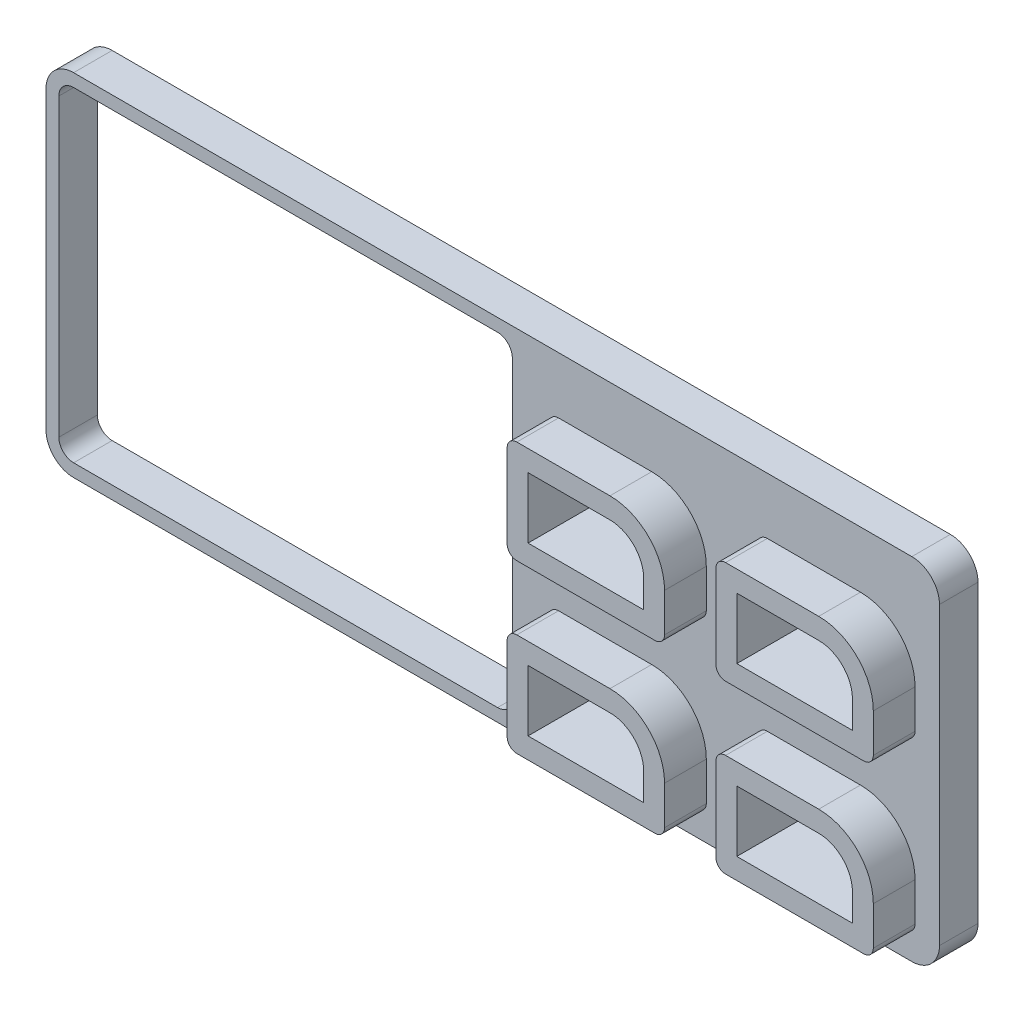
from build123d import *

# Parameters (mm, degrees)
BOSS_EXTRU_1_DEPTH      = 6
BOSS_EXTRU_2_DEPTH      = 9.5
BOSS_EXTRU_3_DEPTH      = 6.5
ENL_V_MAT_EXTRU_1_DEPTH = 87.546230421
ENL_V_MAT_EXTRU_2_DEPTH = 1.25
BOSS_EXTRU_4_DEPTH      = 12.5
BOSS_EXTRU_4_2_DEPTH    = 12.5
BOSS_EXTRU_4_3_DEPTH    = 12.5
BOSS_EXTRU_4_4_DEPTH    = 12.5
BOSS_EXTRU_5_DEPTH      = 6


with BuildPart() as part:
    # Esquisse1 → Boss.-Extru.1 (new body)
    with BuildSketch(Plane.XY):
        with BuildLine():
            Line((2, 0), (68, 0))
            ThreePointArc((68, 0), (69.414213562, 0.585786438), (70, 2))
            Line((70, 2), (70, 48))
            ThreePointArc((70, 48), (69.414213562, 49.414213562), (68, 50))
            Line((68, 50), (2, 50))
            ThreePointArc((2, 50), (0.585786438, 49.414213562), (0, 48))
            Line((0, 48), (0, 2))
            ThreePointArc((0, 2), (0.585786438, 0.585786438), (2, 0))
        make_face()
    extrude(amount=BOSS_EXTRU_1_DEPTH)

    # Esquisse2 → Boss.-Extru.2 (add)
    with BuildSketch(Plane.XY.offset(6)):
        with BuildLine():
            Line((9, 47), (61, 47))
            ThreePointArc((61, 47), (64.535533906, 45.535533906), (66, 42))
            Line((66, 42), (66, 27))
            ThreePointArc((66, 27), (64.535533906, 23.464466094), (61, 22))
            Line((61, 22), (56.5, 22))
            Line((56.5, 22), (56.5, 25.5))
            Line((56.5, 25.5), (60, 25.5))
            ThreePointArc((60, 25.5), (61.767766953, 26.232233047), (62.5, 28))
            Line((62.5, 28), (62.5, 41))
            ThreePointArc((62.5, 41), (61.767766953, 42.767766953), (60, 43.5))
            Line((60, 43.5), (10, 43.5))
            ThreePointArc((10, 43.5), (8.232233047, 42.767766953), (7.5, 41))
            Line((7.5, 41), (7.5, 28))
            ThreePointArc((7.5, 28), (8.232233047, 26.232233047), (10, 25.5))
            Line((10, 25.5), (13.5, 25.5))
            Line((13.5, 25.5), (13.5, 22))
            Line((13.5, 22), (9, 22))
            ThreePointArc((9, 22), (5.464466094, 23.464466094), (4, 27))
            Line((4, 27), (4, 42))
            ThreePointArc((4, 42), (5.464466094, 45.535533906), (9, 47))
        make_face()
    extrude(amount=BOSS_EXTRU_2_DEPTH)

    # Esquisse4 → Boss.-Extru.3 (add)
    with BuildSketch(Plane.XY.offset(6)):
        with BuildLine():
            Line((45, 1.5), (66.5, 1.5))
            ThreePointArc((66.5, 1.5), (67.560660172, 1.939339828), (68, 3))
            Line((68, 3), (68, 9))
            ThreePointArc((68, 9), (65.51040764, 15.01040764), (59.5, 17.5))
            Line((59.5, 17.5), (45, 17.5))
            ThreePointArc((45, 17.5), (43.939339828, 17.060660172), (43.5, 16))
            Line((43.5, 16), (43.5, 3))
            ThreePointArc((43.5, 3), (43.939339828, 1.939339828), (45, 1.5))
        make_face()
        with BuildLine():
            Line((46.75, 4.75), (46.75, 14.25))
            Line((46.75, 14.25), (59.5, 14.25))
            ThreePointArc((59.5, 14.25), (63.212310601, 12.712310601), (64.75, 9))
            Line((64.75, 9), (64.75, 4.75))
            Line((64.75, 4.75), (46.75, 4.75))
        make_face(mode=Mode.SUBTRACT)
    extrude(amount=BOSS_EXTRU_3_DEPTH)

    # Esquisse5 → Enlèv. mat.-Extru.1 (cut, through all)
    with BuildSketch(Plane.XY.offset(6)):
        with BuildLine():
            Line((46.75, 4.75), (64.75, 4.75))
            Line((64.75, 4.75), (64.75, 9))
            ThreePointArc((64.75, 9), (63.212310601, 12.712310601), (59.5, 14.25))
            Line((59.5, 14.25), (46.75, 14.25))
            Line((46.75, 14.25), (46.75, 4.75))
        make_face()
        with BuildLine():
            Line((60, 25.5), (10, 25.5))
            ThreePointArc((10, 25.5), (8.232233047, 26.232233047), (7.5, 28))
            Line((7.5, 28), (7.5, 41))
            ThreePointArc((7.5, 41), (8.232233047, 42.767766953), (10, 43.5))
            Line((10, 43.5), (60, 43.5))
            ThreePointArc((60, 43.5), (61.767766953, 42.767766953), (62.5, 41))
            Line((62.5, 41), (62.5, 28))
            ThreePointArc((62.5, 28), (61.767766953, 26.232233047), (60, 25.5))
        make_face()
    extrude(amount=-ENL_V_MAT_EXTRU_1_DEPTH, mode=Mode.SUBTRACT)

    # Esquisse6 → Enlèv. mat.-Extru.2 (cut)
    # profile 1 of 6: a face of its own
    with BuildSketch(Plane.XY.offset(6)):
        with BuildLine():
            add(Edge.make_bspline(
                [(9.98125, 9.15), (9.94151225, 9.152572673), (9.863195503, 9.157642999), (9.753210696, 9.208851358), (9.655170057, 9.288929049), (9.60457435, 9.360022023), (9.577929688, 9.397460938)],
                knots=[0, 0, 0, 0, 0.959160072, 1.890351017, 2.889018652, 4, 4, 4, 4], degree=3))
            add(Edge.make_bspline(
                [(9.577929688, 9.397460938), (9.555039589, 9.437994011), (9.503936785, 9.528485264), (9.444559776, 9.689977546), (9.383582079, 9.884507049), (9.350820269, 10.027438016), (9.333203125, 10.104296875)],
                knots=[0, 0, 0, 0, 0.742751013, 1.658213032, 2.74074123, 4, 4, 4, 4], degree=3))
            Line((9.333203125, 10.104296875), (9.170507813, 10.897265625))
            add(Edge.make_bspline(
                [(9.170507813, 10.897265625), (9.162063675, 10.930478046), (9.144190904, 11.000775102), (9.120790184, 11.114387165), (9.090669195, 11.240473819), (9.063224027, 11.382219058), (9.030938447, 11.536818991), (9.000199405, 11.706212518), (8.966098288, 11.888970437), (8.928359571, 12.08553135), (8.892511406, 12.296435224), (8.852248192, 12.520464411), (8.811201363, 12.758809908), (8.769390414, 13.011457122), (8.723780906, 13.277899485), (8.677478841, 13.558204991), (8.629563722, 13.852141071), (8.597594428, 14.052724412), (8.58125, 14.155273438)],
                knots=[0, 0, 0, 0, 0.496658207, 1.051221438, 1.68101768, 2.375400972, 3.143623008, 3.970205625, 4.870641242, 5.838436678, 6.871229342, 7.971369117, 9.137717576, 10.376808206, 11.683232474, 13.055897193, 14.494815811, 16, 16, 16, 16], degree=3))
            Line((8.58125, 14.155273438), (7.643359375, 11.373046875))
            Line((7.643359375, 11.373046875), (7.365820313, 10.496679688))
            add(Edge.make_bspline(
                [(7.365820313, 10.496679688), (7.338399285, 10.413435477), (7.285871215, 10.253971808), (7.197076337, 10.029299386), (7.110227316, 9.826640315), (7.045261396, 9.702448964), (7.014453125, 9.643554688)],
                knots=[0, 0, 0, 0, 1.138108356, 2.180174859, 3.13699879, 4, 4, 4, 4], degree=3))
            add(Edge.make_bspline(
                [(7.014453125, 9.643554688), (6.998289241, 9.617971786), (6.966916713, 9.568317859), (6.909732883, 9.50452134), (6.850756066, 9.448298498), (6.786364608, 9.402949233), (6.717025251, 9.368507163), (6.643911558, 9.343787748), (6.566658978, 9.328283944), (6.513679359, 9.326107542), (6.48671875, 9.325)],
                knots=[0, 0, 0, 0, 1.12138879, 2.176506675, 3.170017907, 4.141537379, 5.087232601, 6.03413754, 6.999599269, 8, 8, 8, 8], degree=3))
            add(Edge.make_bspline(
                [(6.48671875, 9.325), (6.442895177, 9.327946144), (6.356824973, 9.333732419), (6.236381954, 9.386429395), (6.131236088, 9.471412651), (6.080120224, 9.547570594), (6.053320313, 9.5875)],
                knots=[0, 0, 0, 0, 0.986319395, 1.937147192, 2.918451782, 4, 4, 4, 4], degree=3))
            add(Edge.make_bspline(
                [(6.053320313, 9.5875), (6.035855727, 9.621866875), (5.999476197, 9.693454648), (5.954588697, 9.811564935), (5.90666618, 9.940597662), (5.880828501, 10.032979854), (5.867382813, 10.081054688)],
                knots=[0, 0, 0, 0, 0.874902059, 1.822461019, 2.866828981, 4, 4, 4, 4], degree=3))
            Line((5.867382813, 10.081054688), (5.733398438, 10.59375))
            add(Edge.make_bspline(
                [(5.733398438, 10.59375), (5.656503387, 10.869589158), (5.500506422, 11.429183974), (5.28647453, 12.287066879), (5.086738125, 13.173788865), (4.966930141, 13.776291049), (4.90625, 14.081445313)],
                knots=[0, 0, 0, 0, 0.958328754, 1.944161251, 2.958762347, 4, 4, 4, 4], degree=3))
            Line((4.90625, 14.081445313), (4.743554688, 13.2625))
            Line((4.743554688, 13.2625), (4.1625, 10.8453125))
            add(Edge.make_bspline(
                [(4.1625, 10.8453125), (4.159128915, 10.807911974), (4.151961622, 10.7283944), (4.134718723, 10.603184869), (4.114668068, 10.464942037), (4.08826968, 10.314124246), (4.056624354, 10.150630351), (4.021006682, 9.974272122), (3.981550861, 9.784994838), (3.952148665, 9.654905267), (3.936914063, 9.5875)],
                knots=[0, 0, 0, 0, 0.704684958, 1.498236636, 2.371575818, 3.326349705, 4.371405418, 5.496944069, 6.703053969, 8, 8, 8, 8], degree=3))
            add(Edge.make_bspline(
                [(3.936914063, 9.5875), (3.925292565, 9.559816052), (3.902977927, 9.506659624), (3.859959142, 9.435525488), (3.813644305, 9.373538656), (3.759625567, 9.323968639), (3.70011878, 9.284889215), (3.634820258, 9.257348339), (3.564073136, 9.240403308), (3.515005519, 9.238484143), (3.48984375, 9.2375)],
                knots=[0, 0, 0, 0, 1.182980922, 2.271462135, 3.271240398, 4.225523803, 5.148115151, 6.066492127, 7.00850128, 8, 8, 8, 8], degree=3))
            add(Edge.make_bspline(
                [(3.48984375, 9.2375), (3.454472301, 9.238987729), (3.386404423, 9.241850676), (3.290904348, 9.273867009), (3.20538017, 9.323395776), (3.161073954, 9.371539251), (3.138476563, 9.39609375)],
                knots=[0, 0, 0, 0, 1.060616523, 2.041022336, 3.000867405, 4, 4, 4, 4], degree=3))
            add(Edge.make_bspline(
                [(3.138476563, 9.39609375), (3.12104166, 9.419179036), (3.085832988, 9.465798296), (3.051523678, 9.547863698), (3.028089071, 9.636777468), (3.026050694, 9.698987924), (3.025, 9.731054688)],
                knots=[0, 0, 0, 0, 0.958743918, 1.936122096, 2.936161401, 4, 4, 4, 4], degree=3))
            add(Edge.make_bspline(
                [(3.025, 9.731054688), (3.026353012, 9.795783944), (3.029137867, 9.929013783), (3.042627838, 10.133943057), (3.068218521, 10.349523947), (3.102129656, 10.575737195), (3.146634661, 10.81314601), (3.199268474, 11.061430494), (3.264501854, 11.319927567), (3.312277094, 11.495260953), (3.33671875, 11.584960938)],
                knots=[0, 0, 0, 0, 0.824042072, 1.69609536, 2.612788883, 3.586582681, 4.607146524, 5.686861406, 6.816605879, 8, 8, 8, 8], degree=3))
            Line((3.33671875, 11.584960938), (3.833007813, 13.445703125))
            Line((3.833007813, 13.445703125), (4.094140625, 14.899023438))
            add(Edge.make_bspline(
                [(4.094140625, 14.899023438), (4.110582906, 14.980233399), (4.142162068, 15.136205836), (4.19403641, 15.358138464), (4.245898421, 15.558306367), (4.297370459, 15.736416976), (4.349692009, 15.892468872), (4.405229653, 16.025660067), (4.45769822, 16.138512248), (4.499107174, 16.202764612), (4.51796875, 16.23203125)],
                knots=[0, 0, 0, 0, 1.414207589, 2.716137283, 3.889666348, 4.943215356, 5.880445309, 6.696617245, 7.406315533, 8, 8, 8, 8], degree=3))
            add(Edge.make_bspline(
                [(4.51796875, 16.23203125), (4.548533457, 16.272930794), (4.6064531, 16.350434791), (4.717889984, 16.43574033), (4.839406063, 16.49138048), (4.925721464, 16.497115246), (4.969140625, 16.5)],
                knots=[0, 0, 0, 0, 1.116006581, 2.11481503, 3.051697038, 4, 4, 4, 4], degree=3))
            add(Edge.make_bspline(
                [(4.969140625, 16.5), (4.993398198, 16.499036319), (5.040679835, 16.49715796), (5.108511714, 16.4799833), (5.171594618, 16.453252287), (5.231241217, 16.417001332), (5.282784712, 16.365386574), (5.332355351, 16.307122891), (5.377081606, 16.23748239), (5.400068156, 16.185456331), (5.412109375, 16.158203125)],
                knots=[0, 0, 0, 0, 0.974538665, 1.899521645, 2.795144295, 3.726104902, 4.685870392, 5.714123837, 6.802572119, 8, 8, 8, 8], degree=3))
            add(Edge.make_bspline(
                [(5.412109375, 16.158203125), (5.428114759, 16.119657968), (5.463249552, 16.035044184), (5.508759543, 15.89174731), (5.554057721, 15.722035918), (5.60407409, 15.526430897), (5.652702557, 15.303353512), (5.701269434, 15.05336241), (5.751957602, 14.777187689), (5.784678347, 14.584156311), (5.801757813, 14.483398438)],
                knots=[0, 0, 0, 0, 0.581236301, 1.275921689, 2.09225498, 3.028489211, 4.088314635, 5.272448532, 6.576281799, 8, 8, 8, 8], degree=3))
            add(Edge.make_bspline(
                [(5.801757813, 14.483398438), (5.823031102, 14.355685849), (5.866113547, 14.097043652), (5.942758506, 13.706413045), (6.023898552, 13.306785849), (6.115469469, 12.899721392), (6.217726181, 12.485453636), (6.324923357, 12.062514015), (6.442655583, 11.632407427), (6.526446051, 11.343772331), (6.56875, 11.198046875)],
                knots=[0, 0, 0, 0, 0.920409794, 1.864004282, 2.829825251, 3.819421933, 4.829969225, 5.863304241, 6.92122972, 8, 8, 8, 8], degree=3))
            add(Edge.make_bspline(
                [(6.56875, 11.198046875), (6.682155475, 11.496367429), (6.910229065, 12.096329995), (7.222165177, 13.012908722), (7.511715835, 13.947889969), (7.683937107, 14.580851692), (7.770507813, 14.899023438)],
                knots=[0, 0, 0, 0, 0.983642058, 1.97823584, 2.98371701, 4, 4, 4, 4], degree=3))
            Line((7.770507813, 14.899023438), (7.911328125, 15.573046875))
            add(Edge.make_bspline(
                [(7.911328125, 15.573046875), (7.925476872, 15.637540159), (7.952577765, 15.761072339), (8.005515675, 15.934576295), (8.060410553, 16.090642404), (8.108565823, 16.183711011), (8.131445313, 16.227929688)],
                knots=[0, 0, 0, 0, 1.142374087, 2.188134223, 3.139147904, 4, 4, 4, 4], degree=3))
            add(Edge.make_bspline(
                [(8.131445313, 16.227929688), (8.146172186, 16.256653629), (8.174481358, 16.311869081), (8.227613444, 16.384044343), (8.282088562, 16.447413009), (8.342677808, 16.497667809), (8.406522637, 16.538808133), (8.474957802, 16.567441894), (8.548053684, 16.584588128), (8.598017581, 16.58651311), (8.623632813, 16.5875)],
                knots=[0, 0, 0, 0, 1.199142974, 2.305088297, 3.326121748, 4.301047848, 5.223219202, 6.142892288, 7.047907664, 8, 8, 8, 8], degree=3))
            add(Edge.make_bspline(
                [(8.623632813, 16.5875), (8.655883833, 16.585132725), (8.720720824, 16.580373588), (8.813686475, 16.540809425), (8.898020466, 16.476190969), (8.978882717, 16.390489263), (9.048344115, 16.276486198), (9.115321834, 16.141338256), (9.175332362, 15.980796661), (9.20788859, 15.864537268), (9.225195313, 15.802734375)],
                knots=[0, 0, 0, 0, 0.729308629, 1.466191666, 2.249505672, 3.126830601, 4.121493211, 5.262973959, 6.545011104, 8, 8, 8, 8], degree=3))
            add(Edge.make_bspline(
                [(9.225195313, 15.802734375), (9.231852988, 15.77819025), (9.246796308, 15.72310034), (9.264534003, 15.630571858), (9.285354113, 15.52080947), (9.307368515, 15.393729578), (9.328683573, 15.248638587), (9.351883716, 15.086392029), (9.376685821, 14.906401094), (9.392996762, 14.780546191), (9.4015625, 14.714453125)],
                knots=[0, 0, 0, 0, 0.553116127, 1.241483132, 2.04851274, 2.984162884, 4.047067603, 5.238941889, 6.55002235, 8, 8, 8, 8], degree=3))
            add(Edge.make_bspline(
                [(9.4015625, 14.714453125), (9.424472836, 14.543510031), (9.469411387, 14.208205706), (9.54128262, 13.71482398), (9.619909618, 13.24153677), (9.699547544, 12.786308182), (9.786561858, 12.350917727), (9.87426295, 11.933409188), (9.968901843, 11.535732967), (10.035968408, 11.277691215), (10.06875, 11.1515625)],
                knots=[0, 0, 0, 0, 1.141110976, 2.238285472, 3.29858376, 4.315316321, 5.295745137, 6.236035004, 7.137788224, 8, 8, 8, 8], degree=3))
            Line((10.06875, 11.1515625), (10.290234375, 10.35859375))
            add(Edge.make_bspline(
                [(10.290234375, 10.35859375), (10.304152607, 10.309897656), (10.330495592, 10.217730742), (10.364191713, 10.085641741), (10.394375123, 9.968668577), (10.419762117, 9.866377837), (10.436890026, 9.778512725), (10.451030498, 9.706234173), (10.460244137, 9.648340815), (10.461821186, 9.614409735), (10.4625, 9.599804688)],
                knots=[0, 0, 0, 0, 1.559778982, 2.952187862, 4.198165584, 5.280768401, 6.197425036, 6.954465388, 7.549967658, 8, 8, 8, 8], degree=3))
            add(Edge.make_bspline(
                [(10.4625, 9.599804688), (10.460614745, 9.569071514), (10.456906327, 9.50861738), (10.428729188, 9.421732281), (10.380767792, 9.343768475), (10.31642298, 9.276162954), (10.241096223, 9.220981098), (10.158690532, 9.180554741), (10.071676174, 9.154571466), (10.011506374, 9.151529601), (9.98125, 9.15)],
                knots=[0, 0, 0, 0, 1.009991958, 1.986719327, 2.968954602, 3.997799753, 5.038376203, 6.024038288, 7.006387982, 8, 8, 8, 8], degree=3))
        make_face()
    # profile 2 of 6: a face of its own
    with BuildSketch(Plane.XY.offset(6)):
        with BuildLine():
            add(Edge.make_bspline(
                [(16.54375, 9.325), (16.507536074, 9.328565585), (16.432608606, 9.335942865), (16.326602225, 9.396120328), (16.225610725, 9.487618401), (16.131539169, 9.616736153), (16.038121522, 9.778218947), (15.951174204, 9.976013991), (15.866187745, 10.208556854), (15.816750923, 10.376947), (15.790429688, 10.466601563)],
                knots=[0, 0, 0, 0, 0.599477061, 1.240332184, 1.981336902, 2.857725237, 3.883632495, 5.081363646, 6.446054773, 8, 8, 8, 8], degree=3))
            add(Edge.make_bspline(
                [(15.790429688, 10.466601563), (15.779364183, 10.505302667), (15.755474944, 10.588854211), (15.71991042, 10.724120632), (15.683440927, 10.879306311), (15.643453762, 11.054142275), (15.602836847, 11.249302879), (15.560648196, 11.464541498), (15.515617335, 11.699261103), (15.48502816, 11.862488099), (15.469140625, 11.947265625)],
                knots=[0, 0, 0, 0, 0.637338617, 1.375945868, 2.214304435, 3.161358364, 4.215706084, 5.370487761, 6.634272836, 8, 8, 8, 8], degree=3))
            add(Edge.make_bspline(
                [(15.469140625, 11.947265625), (15.387937427, 11.934530903), (15.213659683, 11.907199731), (14.935787991, 11.852654767), (14.62282044, 11.785403771), (14.402668317, 11.734737591), (14.286523438, 11.708007812)],
                knots=[0, 0, 0, 0, 0.817199407, 1.753867738, 2.815015916, 4, 4, 4, 4], degree=3))
            Line((14.286523438, 11.708007812), (13.109375, 11.445507813))
            add(Edge.make_bspline(
                [(13.109375, 11.445507813), (13.087651476, 11.392124657), (13.04145529, 11.278602642), (12.965094843, 11.10029647), (12.877606786, 10.904751644), (12.778006467, 10.692668744), (12.671048039, 10.461138264), (12.550143165, 10.213472963), (12.420421388, 9.947478818), (12.329323456, 9.765157225), (12.282226563, 9.670898438)],
                knots=[0, 0, 0, 0, 0.706283328, 1.501947701, 2.37692242, 3.331414503, 4.373290632, 5.502321144, 6.708720252, 8, 8, 8, 8], degree=3))
            add(Edge.make_bspline(
                [(12.282226563, 9.670898438), (12.25762778, 9.631616858), (12.211341109, 9.557702077), (12.116699493, 9.473585909), (12.0076584, 9.421463966), (11.92959772, 9.415524694), (11.88984375, 9.4125)],
                knots=[0, 0, 0, 0, 1.121846996, 2.110940414, 3.037958462, 4, 4, 4, 4], degree=3))
            add(Edge.make_bspline(
                [(11.88984375, 9.4125), (11.860461387, 9.413913191), (11.801874975, 9.416730998), (11.717711394, 9.444642321), (11.637710506, 9.486347891), (11.564783249, 9.544409483), (11.504306702, 9.616370203), (11.456756219, 9.697042382), (11.431027995, 9.78787801), (11.427034679, 9.850768483), (11.425, 9.8828125)],
                knots=[0, 0, 0, 0, 0.959520236, 1.91321738, 2.874709434, 3.905108448, 4.94294104, 5.939035053, 6.949895042, 8, 8, 8, 8], degree=3))
            add(Edge.make_bspline(
                [(11.425, 9.8828125), (11.425677693, 9.893778715), (11.427243904, 9.919122661), (11.436305973, 9.961573968), (11.450737288, 10.013656046), (11.4672727, 10.076342009), (11.493752051, 10.14746261), (11.52107262, 10.229865272), (11.557813976, 10.320699165), (11.596801958, 10.422304152), (11.642576515, 10.533247664), (11.692450489, 10.65431778), (11.74921209, 10.784818465), (11.810727875, 10.924984751), (11.875799047, 11.076026087), (11.94869937, 11.235596519), (12.026728231, 11.404871319), (12.07991271, 11.521144948), (12.107226563, 11.580859375)],
                knots=[0, 0, 0, 0, 0.287252042, 0.663866255, 1.132542321, 1.702696392, 2.359033657, 3.117250718, 3.974454919, 4.922446686, 5.965676152, 7.11530323, 8.349438451, 9.690101266, 11.121599063, 12.65362027, 14.281406117, 16, 16, 16, 16], degree=3))
            add(Edge.make_bspline(
                [(12.107226563, 11.580859375), (12.095205464, 11.601506769), (12.071198403, 11.642741207), (12.046195032, 11.71098037), (12.033039273, 11.784062892), (12.030560908, 11.834196252), (12.029296875, 11.859765625)],
                knots=[0, 0, 0, 0, 0.97569968, 1.948547473, 2.953703556, 4, 4, 4, 4], degree=3))
            add(Edge.make_bspline(
                [(12.029296875, 11.859765625), (12.030564654, 11.889939801), (12.033017035, 11.948308483), (12.053179833, 12.032014057), (12.090602164, 12.10561148), (12.13815059, 12.17319498), (12.203119831, 12.22874239), (12.279378409, 12.277978072), (12.371137497, 12.315309671), (12.437428678, 12.333952783), (12.472265625, 12.34375)],
                knots=[0, 0, 0, 0, 1.009779751, 1.953309833, 2.853929492, 3.760216721, 4.700287016, 5.694855049, 6.788613926, 8, 8, 8, 8], degree=3))
            add(Edge.make_bspline(
                [(12.472265625, 12.34375), (12.516325928, 12.426770492), (12.606371171, 12.596437967), (12.747227716, 12.855087799), (12.897413309, 13.122485265), (13.056664472, 13.398481388), (13.221739586, 13.684964644), (13.396471267, 13.980011381), (13.581728953, 14.283023234), (13.707292343, 14.488411385), (13.77109375, 14.592773438)],
                knots=[0, 0, 0, 0, 0.868367668, 1.774667265, 2.721024516, 3.701824684, 4.718674562, 5.775854077, 6.869864537, 8, 8, 8, 8], degree=3))
            add(Edge.make_bspline(
                [(13.77109375, 14.592773438), (13.815130039, 14.662608689), (13.900835752, 14.798525684), (14.028175701, 14.994236668), (14.146218204, 15.178181707), (14.260441925, 15.346793437), (14.368266833, 15.501696885), (14.46778168, 15.644746484), (14.561960468, 15.77344413), (14.650905041, 15.887564915), (14.731799425, 15.98975151), (14.805888776, 16.078399739), (14.875242808, 16.152300533), (14.935466571, 16.214931929), (14.992275733, 16.261508521), (15.040940791, 16.296176013), (15.083923265, 16.319756585), (15.112106617, 16.323388709), (15.124609375, 16.325)],
                knots=[0, 0, 0, 0, 1.783354216, 3.470856639, 5.0436238, 6.504355625, 7.869725228, 9.120561833, 10.268459323, 11.314034723, 12.245706296, 13.083911902, 13.808382701, 14.434865381, 14.959203251, 15.390667921, 15.729686815, 16, 16, 16, 16], degree=3))
            add(Edge.make_bspline(
                [(15.124609375, 16.325), (15.153944582, 16.323447428), (15.210862302, 16.320435046), (15.292913508, 16.296035823), (15.367231786, 16.255953105), (15.434598298, 16.19999998), (15.491533063, 16.126587706), (15.544306187, 16.040017221), (15.587316522, 15.936398531), (15.609336888, 15.861303051), (15.620898438, 15.821875)],
                knots=[0, 0, 0, 0, 0.917322695, 1.779838015, 2.65454497, 3.546200046, 4.500090635, 5.550022207, 6.713666244, 8, 8, 8, 8], degree=3))
            Line((15.620898438, 15.821875), (15.917578125, 14.27421875))
            Line((15.917578125, 14.27421875), (16.6203125, 11.070898438))
            Line((16.6203125, 11.070898438), (16.88828125, 10.318945313))
            add(Edge.make_bspline(
                [(16.88828125, 10.318945313), (16.909005878, 10.26035528), (16.946523395, 10.154290523), (16.987971993, 10.009418378), (17.017986515, 9.897191516), (17.022948872, 9.831878941), (17.025, 9.804882813)],
                knots=[0, 0, 0, 0, 1.397155254, 2.529251602, 3.392084717, 4, 4, 4, 4], degree=3))
            add(Edge.make_bspline(
                [(17.025, 9.804882813), (17.023123196, 9.772332192), (17.019432209, 9.708317037), (16.991382828, 9.616791679), (16.944693063, 9.533442771), (16.880954012, 9.461474286), (16.806082373, 9.4010565), (16.723591166, 9.356969944), (16.635284445, 9.329183436), (16.574484659, 9.326404679), (16.54375, 9.325)],
                knots=[0, 0, 0, 0, 1.035843273, 2.037124518, 3.018631196, 4.058029714, 5.080662642, 6.067951126, 7.02333764, 8, 8, 8, 8], degree=3))
        make_face()
        with BuildLine():
            Line((14.88125, 14.65703125), (13.69453125, 12.570703125))
            add(Edge.make_bspline(
                [(13.69453125, 12.570703125), (13.740514866, 12.582285421), (13.837743248, 12.606775185), (13.992539452, 12.641512052), (14.163044415, 12.680722848), (14.351196407, 12.718125159), (14.555829596, 12.759055244), (14.776999698, 12.803565221), (15.015250076, 12.846341988), (15.179307554, 12.876441999), (15.2640625, 12.891992188)],
                knots=[0, 0, 0, 0, 0.710206803, 1.501670901, 2.376034108, 3.330493633, 4.374633661, 5.501772615, 6.709372284, 8, 8, 8, 8], degree=3))
            Line((15.2640625, 12.891992188), (14.88125, 14.65703125))
        make_face(mode=Mode.SUBTRACT)
    # profile 3 of 6: a face of its own
    with BuildSketch(Plane.XY.offset(6)):
        with BuildLine():
            add(Edge.make_bspline(
                [(22.950390625, 9.4125), (22.92238765, 9.414510918), (22.865540144, 9.418593187), (22.782278573, 9.447190523), (22.702332537, 9.495373725), (22.655250588, 9.538712067), (22.63046875, 9.561523438)],
                knots=[0, 0, 0, 0, 0.92759402, 1.883064472, 2.885739552, 4, 4, 4, 4], degree=3))
            add(Edge.make_bspline(
                [(22.63046875, 9.561523438), (22.505127147, 9.685094519), (22.257579548, 9.929145367), (21.867277515, 10.265936566), (21.46539548, 10.570250692), (21.053812761, 10.844216362), (20.631658252, 11.087395088), (20.198511969, 11.298070362), (19.755377923, 11.479192469), (19.451602907, 11.573461577), (19.3, 11.620507813)],
                knots=[0, 0, 0, 0, 1.06668371, 2.106682745, 3.122149944, 4.120443899, 5.101746213, 6.072804342, 7.03820772, 8, 8, 8, 8], degree=3))
            Line((19.3, 11.620507813), (19.3, 10.7140625))
            Line((19.3, 10.7140625), (19.3, 9.802148438))
            add(Edge.make_bspline(
                [(19.3, 9.802148438), (19.298575439, 9.769619921), (19.295777751, 9.705737357), (19.269213465, 9.614153806), (19.224138455, 9.531752829), (19.163822567, 9.459886848), (19.092007962, 9.398794664), (19.007981672, 9.356450611), (18.916170204, 9.328930531), (18.851767086, 9.326332112), (18.81875, 9.325)],
                knots=[0, 0, 0, 0, 1.030253241, 2.023308341, 2.993791058, 3.989789173, 4.985787287, 5.962283232, 6.955338332, 8, 8, 8, 8], degree=3))
            add(Edge.make_bspline(
                [(18.81875, 9.325), (18.785742823, 9.326344805), (18.721359032, 9.328967981), (18.629408852, 9.356310377), (18.545839957, 9.399346378), (18.472022478, 9.457984244), (18.411835379, 9.530139876), (18.368578352, 9.613162113), (18.341629188, 9.704326001), (18.338893163, 9.768237831), (18.3375, 9.80078125)],
                knots=[0, 0, 0, 0, 1.045277453, 2.038917917, 3.015989466, 4.014672757, 5.011257971, 5.975499002, 6.969139467, 8, 8, 8, 8], degree=3))
            add(Edge.make_bspline(
                [(18.3375, 9.80078125), (18.337723518, 9.833141132), (18.338195817, 9.901518618), (18.334211463, 10.009492975), (18.332730982, 10.128957481), (18.32591871, 10.259220182), (18.32171365, 10.401046565), (18.31213825, 10.553607753), (18.305335006, 10.717795126), (18.293043105, 10.888995802), (18.284890182, 11.06091105), (18.274015453, 11.225314296), (18.268529703, 11.378549592), (18.260204324, 11.520182528), (18.257493838, 11.650606668), (18.252032287, 11.769948174), (18.251610624, 11.877999826), (18.250517444, 11.946355564), (18.25, 11.978710938)],
                knots=[0, 0, 0, 0, 0.712445534, 1.505420618, 2.378647905, 3.342790384, 4.377117212, 5.50258648, 6.708224005, 7.995139022, 9.281467094, 10.497664906, 11.622642009, 12.657406812, 13.6211837, 14.49469921, 15.287483804, 16, 16, 16, 16], degree=3))
            add(Edge.make_bspline(
                [(18.25, 11.978710938), (18.250292594, 12.016539548), (18.250909659, 12.09631791), (18.255317283, 12.22211666), (18.262231396, 12.360667355), (18.271907627, 12.512430791), (18.284213627, 12.677413705), (18.299326666, 12.855149892), (18.317169571, 13.045644775), (18.33748721, 13.244727763), (18.357926095, 13.444255114), (18.375599003, 13.635221746), (18.39072972, 13.81295506), (18.403085284, 13.977022097), (18.412818415, 14.127871345), (18.419639956, 14.265515151), (18.424093913, 14.390400289), (18.42470868, 14.469267633), (18.425, 14.506640625)],
                knots=[0, 0, 0, 0, 0.71629614, 1.510627306, 2.383268869, 3.343040369, 4.390087922, 5.51592497, 6.720652734, 8.012939535, 9.305226336, 10.51854632, 11.644383367, 12.682825442, 13.633984758, 14.506626321, 15.292332674, 16, 16, 16, 16], degree=3))
            add(Edge.make_bspline(
                [(18.425, 14.506640625), (18.424371088, 14.550855493), (18.422982756, 14.64846043), (18.413898385, 14.808900614), (18.400245784, 14.99759589), (18.38125, 15.205273438), (18.362254216, 15.412950985), (18.348601615, 15.601646261), (18.339517244, 15.762086445), (18.338128912, 15.859691382), (18.3375, 15.90390625)],
                knots=[0, 0, 0, 0, 0.757749544, 1.672742668, 2.753375099, 4, 5.246624901, 6.327257332, 7.242250456, 8, 8, 8, 8], degree=3))
            add(Edge.make_bspline(
                [(18.3375, 15.90390625), (18.3393976, 15.94643752), (18.343131374, 16.030123308), (18.37085098, 16.151320483), (18.417670591, 16.265008777), (18.463397339, 16.332089732), (18.486523438, 16.366015625)],
                knots=[0, 0, 0, 0, 1.032692214, 2.03195585, 3.004670488, 4, 4, 4, 4], degree=3))
            add(Edge.make_bspline(
                [(18.486523438, 16.366015625), (18.517044009, 16.403076696), (18.576507203, 16.475282737), (18.695889264, 16.549213446), (18.831601871, 16.58986915), (18.926472352, 16.588312351), (18.975976563, 16.5875)],
                knots=[0, 0, 0, 0, 1.01891203, 1.985145153, 2.948631896, 4, 4, 4, 4], degree=3))
            Line((18.975976563, 16.5875), (20.0984375, 16.5))
            add(Edge.make_bspline(
                [(20.0984375, 16.5), (20.20082844, 16.48525505), (20.399327452, 16.456669923), (20.682000698, 16.388090857), (20.941102792, 16.302030268), (21.099006604, 16.225494042), (21.17578125, 16.18828125)],
                knots=[0, 0, 0, 0, 1.100642549, 2.133747954, 3.092606825, 4, 4, 4, 4], degree=3))
            add(Edge.make_bspline(
                [(21.17578125, 16.18828125), (21.252287922, 16.147059192), (21.402085268, 16.066347868), (21.615675484, 15.935691733), (21.815127668, 15.802198266), (22.000015549, 15.665453196), (22.170354521, 15.526007768), (22.325420712, 15.382419869), (22.464850714, 15.234227421), (22.591181779, 15.084151525), (22.702690238, 14.930469398), (22.799043555, 14.772878426), (22.879244074, 14.610951494), (22.947750004, 14.446700368), (22.997557171, 14.277699156), (23.034593311, 14.105920016), (23.059303933, 13.930859032), (23.061431984, 13.812647661), (23.0625, 13.753320313)],
                knots=[0, 0, 0, 0, 1.285088098, 2.516156837, 3.70133193, 4.833679489, 5.915871266, 6.955543635, 7.956797627, 8.923330369, 9.854944987, 10.762351267, 11.651551949, 12.525187581, 13.390909519, 14.252845023, 15.123146355, 16, 16, 16, 16], degree=3))
            add(Edge.make_bspline(
                [(23.0625, 13.753320313), (23.060818915, 13.695302631), (23.057486362, 13.580289374), (23.025843292, 13.410470425), (22.975881802, 13.245766492), (22.902527622, 13.087133827), (22.813144739, 12.932008513), (22.700138336, 12.783813572), (22.569094311, 12.639255424), (22.46871611, 12.551496093), (22.4171875, 12.506445313)],
                knots=[0, 0, 0, 0, 0.958014663, 1.899151822, 2.844979062, 3.795592604, 4.781247835, 5.798066499, 6.869649273, 8, 8, 8, 8], degree=3))
            add(Edge.make_bspline(
                [(22.4171875, 12.506445313), (22.372918009, 12.470837154), (22.283515343, 12.398926132), (22.141235348, 12.299864386), (21.991614403, 12.205847714), (21.83310445, 12.120653755), (21.666958147, 12.040344199), (21.491933387, 11.969152915), (21.310036543, 11.900976333), (21.184664559, 11.862744908), (21.12109375, 11.843359375)],
                knots=[0, 0, 0, 0, 0.929713851, 1.877566122, 2.835927701, 3.820636964, 4.821600353, 5.855058901, 6.912391442, 8, 8, 8, 8], degree=3))
            add(Edge.make_bspline(
                [(21.12109375, 11.843359375), (21.23864568, 11.778952798), (21.468066009, 11.653253644), (21.797375765, 11.456097485), (22.102948803, 11.255204567), (22.38745302, 11.053413827), (22.646866964, 10.846732266), (22.884359503, 10.638971065), (23.099166889, 10.428590249), (23.227896318, 10.281479329), (23.290820313, 10.209570313)],
                knots=[0, 0, 0, 0, 1.177489967, 2.298049355, 3.370731458, 4.389520182, 5.361182849, 6.283175119, 7.160802, 8, 8, 8, 8], degree=3))
            add(Edge.make_bspline(
                [(23.290820313, 10.209570313), (23.309379205, 10.185030422), (23.345171872, 10.137702808), (23.384906418, 10.059509993), (23.406940236, 9.977884118), (23.410655227, 9.922579893), (23.4125, 9.895117188)],
                knots=[0, 0, 0, 0, 1.072503085, 2.068428621, 3.040829592, 4, 4, 4, 4], degree=3))
            add(Edge.make_bspline(
                [(23.4125, 9.895117188), (23.411118609, 9.863476997), (23.408405682, 9.801338513), (23.380854999, 9.711517788), (23.336381763, 9.628736266), (23.276559187, 9.554141858), (23.20522507, 9.492041587), (23.126314556, 9.445275538), (23.040034816, 9.418364939), (22.980648846, 9.414479633), (22.950390625, 9.4125)],
                knots=[0, 0, 0, 0, 1.024641278, 2.012303189, 3.018298371, 4.060307688, 5.098529397, 6.072917027, 7.018116539, 8, 8, 8, 8], degree=3))
        make_face()
        with BuildLine():
            Line((19.979492188, 15.568945313), (19.3, 15.625))
            Line((19.3, 15.625), (19.351953125, 15.064453125))
            add(Edge.make_bspline(
                [(19.351953125, 15.064453125), (19.356931875, 15.009766098), (19.366388259, 14.90589635), (19.380383957, 14.757961107), (19.384868696, 14.625610016), (19.386662493, 14.542642832), (19.3875, 14.50390625)],
                knots=[0, 0, 0, 0, 1.172826967, 2.227607707, 3.172487062, 4, 4, 4, 4], degree=3))
            add(Edge.make_bspline(
                [(19.3875, 14.50390625), (19.387430948, 14.438273937), (19.387285137, 14.299682992), (19.378868646, 14.080512688), (19.370480514, 13.838419289), (19.360111633, 13.66944692), (19.3546875, 13.581054688)],
                knots=[0, 0, 0, 0, 0.852682441, 1.800547017, 2.849429868, 4, 4, 4, 4], degree=3))
            Line((19.3546875, 13.581054688), (19.3, 12.659570313))
            add(Edge.make_bspline(
                [(19.3, 12.659570313), (19.326891635, 12.659247301), (19.391633142, 12.658469652), (19.494566386, 12.653559442), (19.598496717, 12.651484424), (19.664583279, 12.650439536), (19.692382813, 12.65)],
                knots=[0, 0, 0, 0, 0.822146546, 1.979314634, 3.149991952, 4, 4, 4, 4], degree=3))
            add(Edge.make_bspline(
                [(19.692382813, 12.65), (19.784455222, 12.651227155), (19.962323103, 12.653597805), (20.220569168, 12.666736501), (20.461161952, 12.690716802), (20.68369085, 12.726562137), (20.888513575, 12.769552387), (21.075550732, 12.822842821), (21.24552326, 12.885521948), (21.34895686, 12.938844132), (21.398632813, 12.964453125)],
                knots=[0, 0, 0, 0, 1.261455283, 2.436912221, 3.541518553, 4.572091567, 5.523601269, 6.40695542, 7.234910064, 8, 8, 8, 8], degree=3))
            add(Edge.make_bspline(
                [(21.398632813, 12.964453125), (21.440099733, 12.989758578), (21.523838727, 13.040860833), (21.642005737, 13.130467108), (21.757190538, 13.229077091), (21.827631314, 13.302875723), (21.863476563, 13.340429688)],
                knots=[0, 0, 0, 0, 0.970995645, 1.960844865, 2.962333636, 4, 4, 4, 4], degree=3))
            add(Edge.make_bspline(
                [(21.863476563, 13.340429688), (21.899360811, 13.380976175), (21.965723864, 13.455961407), (22.039412482, 13.572205852), (22.089263575, 13.678429068), (22.096606423, 13.748349555), (22.1, 13.780664063)],
                knots=[0, 0, 0, 0, 1.272857899, 2.353978121, 3.239273211, 4, 4, 4, 4], degree=3))
            add(Edge.make_bspline(
                [(22.1, 13.780664063), (22.097969529, 13.834154951), (22.093901441, 13.941325031), (22.058406458, 14.099954777), (21.999101372, 14.254251603), (21.921403432, 14.407866005), (21.816920148, 14.556453524), (21.692186994, 14.703585182), (21.542955517, 14.845868818), (21.432577757, 14.934917981), (21.375390625, 14.981054688)],
                knots=[0, 0, 0, 0, 0.882366302, 1.767838804, 2.667832895, 3.606679194, 4.602184672, 5.659035605, 6.787137544, 8, 8, 8, 8], degree=3))
            add(Edge.make_bspline(
                [(21.375390625, 14.981054688), (21.320236706, 15.021785547), (21.211175063, 15.102326957), (21.041883579, 15.21074683), (20.868831136, 15.303216304), (20.695315993, 15.384555504), (20.519496116, 15.452062717), (20.341660536, 15.505131842), (20.161736379, 15.5459194), (20.040267206, 15.561266603), (19.979492188, 15.568945313)],
                knots=[0, 0, 0, 0, 1.072583951, 2.120933036, 3.141837587, 4.140335143, 5.117603438, 6.085357071, 7.042041242, 8, 8, 8, 8], degree=3))
        make_face(mode=Mode.SUBTRACT)
    # profile 4 of 6: a face of its own
    with BuildSketch(Plane.XY.offset(6)):
        with BuildLine():
            add(Edge.make_bspline(
                [(29.875195313, 15.348828125), (29.845571421, 15.34920634), (29.783124599, 15.350003613), (29.683772648, 15.352917005), (29.573488268, 15.357104505), (29.451756856, 15.362181648), (29.319190552, 15.370947848), (29.175177065, 15.380453154), (29.020220866, 15.391303672), (28.913147362, 15.399364531), (28.858007813, 15.403515625)],
                knots=[0, 0, 0, 0, 0.697868793, 1.471099364, 2.34124454, 3.297639375, 4.340941311, 5.470636532, 6.697455892, 8, 8, 8, 8], degree=3))
            add(Edge.make_bspline(
                [(28.858007813, 15.403515625), (28.753210921, 15.411137837), (28.557368604, 15.425382074), (28.283447378, 15.440444643), (28.049611571, 15.449748084), (27.90690768, 15.449921398), (27.8421875, 15.45)],
                knots=[0, 0, 0, 0, 1.239602774, 2.316544658, 3.236506215, 4, 4, 4, 4], degree=3))
            Line((27.8421875, 15.45), (27.525, 15.45))
            add(Edge.make_bspline(
                [(27.525, 15.45), (27.52574906, 15.393030335), (27.527355271, 15.270870224), (27.533527125, 15.074929622), (27.540106198, 14.854349852), (27.548583245, 14.608720233), (27.557602236, 14.338888879), (27.570665174, 14.044079121), (27.583702721, 13.724564527), (27.594563303, 13.503117703), (27.600195313, 13.38828125)],
                knots=[0, 0, 0, 0, 0.662748673, 1.421132645, 2.280353958, 3.229821545, 4.280136861, 5.420916878, 6.662555861, 8, 8, 8, 8], degree=3))
            add(Edge.make_bspline(
                [(27.600195313, 13.38828125), (27.605326267, 13.280734759), (27.615304223, 13.071593518), (27.627895574, 12.766712353), (27.636421387, 12.480444812), (27.647001884, 12.212996662), (27.653825754, 11.964154026), (27.657612696, 11.733535636), (27.66056299, 11.521621148), (27.661345847, 11.386719544), (27.66171875, 11.322460938)],
                knots=[0, 0, 0, 0, 1.250205099, 2.431222486, 3.543103862, 4.575656673, 5.539115669, 6.433559639, 7.253846715, 8, 8, 8, 8], degree=3))
            add(Edge.make_bspline(
                [(27.66171875, 11.322460938), (27.662012762, 11.291922861), (27.662662425, 11.22444442), (27.667660006, 11.112823881), (27.672430645, 10.980611598), (27.681090313, 10.834384754), (27.688427501, 10.688080916), (27.696519153, 10.555089849), (27.698596827, 10.441997388), (27.699564342, 10.373176559), (27.7, 10.3421875)],
                knots=[0, 0, 0, 0, 0.746989454, 1.650584799, 2.732845727, 3.983195791, 5.233545855, 6.316323389, 7.241863914, 8, 8, 8, 8], degree=3))
            add(Edge.make_bspline(
                [(27.7, 10.3421875), (27.698501643, 10.292009962), (27.695590606, 10.1945241), (27.678530155, 10.053718265), (27.647400371, 9.92326437), (27.61570312, 9.842855488), (27.600195313, 9.803515625)],
                knots=[0, 0, 0, 0, 1.091849351, 2.121265404, 3.080833362, 4, 4, 4, 4], degree=3))
            add(Edge.make_bspline(
                [(27.600195313, 9.803515625), (27.589217013, 9.779610744), (27.568253435, 9.733963255), (27.53139939, 9.67126921), (27.48886826, 9.618256355), (27.440224858, 9.576467866), (27.389615603, 9.540150762), (27.332123568, 9.518035605), (27.271643988, 9.501412087), (27.229355195, 9.50047657), (27.2078125, 9.5)],
                knots=[0, 0, 0, 0, 1.191296126, 2.274835755, 3.287394835, 4.252751747, 5.174740045, 6.091162971, 7.027603017, 8, 8, 8, 8], degree=3))
            add(Edge.make_bspline(
                [(27.2078125, 9.5), (27.178456486, 9.50151727), (27.120055151, 9.504535753), (27.03542781, 9.530863808), (26.954780829, 9.571039837), (26.880392229, 9.626277465), (26.817213501, 9.695480476), (26.771494387, 9.776366042), (26.742719566, 9.866336145), (26.739275459, 9.929531682), (26.7375, 9.962109375)],
                knots=[0, 0, 0, 0, 0.960963467, 1.911756486, 2.881171454, 3.906711639, 4.933449695, 5.93104195, 6.933439213, 8, 8, 8, 8], degree=3))
            add(Edge.make_bspline(
                [(26.7375, 9.962109375), (26.738825254, 9.990872928), (26.742017987, 10.060168568), (26.760889084, 10.168989127), (26.779378507, 10.277866645), (26.782639525, 10.347606396), (26.783984375, 10.376367188)],
                knots=[0, 0, 0, 0, 0.827477602, 1.993515503, 3.172522398, 4, 4, 4, 4], degree=3))
            add(Edge.make_bspline(
                [(26.783984375, 10.376367188), (26.783738235, 10.41875405), (26.783190207, 10.513127972), (26.777132663, 10.669010751), (26.767200264, 10.8530891), (26.755440569, 11.055867445), (26.742722688, 11.258577583), (26.735159258, 11.443204342), (26.728647133, 11.599954758), (26.728152215, 11.695242273), (26.727929688, 11.738085938)],
                knots=[0, 0, 0, 0, 0.746291465, 1.661610404, 2.746329365, 3.99217145, 5.238013535, 6.322346595, 7.245684818, 8, 8, 8, 8], degree=3))
            add(Edge.make_bspline(
                [(26.727929688, 11.738085938), (26.727500387, 11.795962949), (26.726601189, 11.917190259), (26.724645893, 12.107279782), (26.716555102, 12.314130331), (26.709193446, 12.537943966), (26.697367345, 12.778514177), (26.686155215, 13.035652873), (26.668595401, 13.309436548), (26.6572293, 13.497653108), (26.651367188, 13.594726563)],
                knots=[0, 0, 0, 0, 0.747431598, 1.565545969, 2.45468398, 3.420487031, 4.457335108, 5.565002064, 6.744139946, 8, 8, 8, 8], degree=3))
            add(Edge.make_bspline(
                [(26.651367188, 13.594726563), (26.644897607, 13.698627352), (26.632442426, 13.898656268), (26.615892146, 14.187584875), (26.602499592, 14.453771624), (26.590458578, 14.697141091), (26.578349672, 14.917627222), (26.572405555, 15.115492301), (26.56663801, 15.290482211), (26.563812281, 15.399412347), (26.5625, 15.45)],
                knots=[0, 0, 0, 0, 1.345045701, 2.589470545, 3.739184836, 4.788629233, 5.737804393, 6.592105666, 7.346167443, 8, 8, 8, 8], degree=3))
            Line((26.5625, 15.45), (26.145507813, 15.445898438))
            add(Edge.make_bspline(
                [(26.145507813, 15.445898438), (26.064382139, 15.446485222), (25.906203813, 15.44762933), (25.675570056, 15.454699619), (25.458502216, 15.464813722), (25.254782876, 15.481761081), (25.064626286, 15.501803702), (24.887548259, 15.525961621), (24.724277822, 15.555938997), (24.620550242, 15.580390901), (24.570507813, 15.5921875)],
                knots=[0, 0, 0, 0, 1.228039821, 2.394424294, 3.492699509, 4.517052489, 5.488393293, 6.38694271, 7.221795155, 8, 8, 8, 8], degree=3))
            add(Edge.make_bspline(
                [(24.570507813, 15.5921875), (24.541011869, 15.600883233), (24.484685655, 15.617488828), (24.408992856, 15.655064678), (24.343769889, 15.699045976), (24.291429793, 15.753411006), (24.249293643, 15.815574331), (24.221218472, 15.886603825), (24.202233209, 15.964894477), (24.200767243, 16.019991805), (24.2, 16.048828125)],
                knots=[0, 0, 0, 0, 1.149028852, 2.19421508, 3.150112674, 4.078991136, 5.001582701, 5.94244518, 6.923136375, 8, 8, 8, 8], degree=3))
            add(Edge.make_bspline(
                [(24.2, 16.048828125), (24.200972051, 16.079559497), (24.202888186, 16.140138098), (24.228265083, 16.226382282), (24.262887707, 16.308790626), (24.299117869, 16.355756902), (24.317578125, 16.3796875)],
                knots=[0, 0, 0, 0, 1.025624002, 2.021740715, 2.992022952, 4, 4, 4, 4], degree=3))
            add(Edge.make_bspline(
                [(24.317578125, 16.3796875), (24.341133316, 16.404194771), (24.386716948, 16.451620856), (24.472352415, 16.501148252), (24.567927351, 16.528258054), (24.634592958, 16.52765467), (24.668945313, 16.52734375)],
                knots=[0, 0, 0, 0, 1.02661616, 1.986691385, 2.962555135, 4, 4, 4, 4], degree=3))
            add(Edge.make_bspline(
                [(24.668945313, 16.52734375), (24.68444747, 16.526536799), (24.719605963, 16.524706656), (24.778399077, 16.518930808), (24.849846571, 16.510286974), (24.934176131, 16.500879811), (25.031788094, 16.490214928), (25.141960567, 16.476042628), (25.265132511, 16.461546986), (25.351188022, 16.449998032), (25.396289062, 16.443945312)],
                knots=[0, 0, 0, 0, 0.5087507, 1.153833472, 1.935733641, 2.867738609, 3.935007618, 5.154125614, 6.508498809, 8, 8, 8, 8], degree=3))
            add(Edge.make_bspline(
                [(25.396289062, 16.443945312), (25.468274172, 16.436024283), (25.605303613, 16.420945968), (25.800260139, 16.402208875), (25.974063176, 16.392759257), (26.082609628, 16.390370986), (26.133203125, 16.389257813)],
                knots=[0, 0, 0, 0, 1.175525529, 2.237707298, 3.178595432, 4, 4, 4, 4], degree=3))
            add(Edge.make_bspline(
                [(26.133203125, 16.389257813), (26.184244143, 16.389770995), (26.298629826, 16.390921065), (26.487779815, 16.391391348), (26.712423508, 16.396815395), (26.96036942, 16.399681613), (27.20826113, 16.405490273), (27.432925422, 16.410251814), (27.622072918, 16.41085743), (27.736458864, 16.411993199), (27.7875, 16.4125)],
                knots=[0, 0, 0, 0, 0.740441683, 1.659369853, 2.743726197, 3.999939121, 5.256273803, 6.340630147, 7.259558317, 8, 8, 8, 8], degree=3))
            add(Edge.make_bspline(
                [(27.7875, 16.4125), (27.818488307, 16.411987535), (27.884109857, 16.410902328), (27.987603054, 16.410394717), (28.101506478, 16.405394155), (28.225984309, 16.400684578), (28.361221846, 16.391270989), (28.507183199, 16.384273999), (28.663423207, 16.372528551), (28.826564282, 16.360576785), (28.990148268, 16.348415791), (29.146416746, 16.337154056), (29.292291584, 16.329051098), (29.427241506, 16.322791972), (29.552021945, 16.315100035), (29.665985487, 16.310872256), (29.769469178, 16.310147303), (29.834636182, 16.309094424), (29.865625, 16.30859375)],
                knots=[0, 0, 0, 0, 0.714819212, 1.513717576, 2.38669285, 3.344109317, 4.386598804, 5.513033055, 6.714223687, 8.000039341, 9.285854994, 10.497530974, 11.613470957, 12.65537741, 13.613313006, 14.496792413, 15.285180788, 16, 16, 16, 16], degree=3))
            add(Edge.make_bspline(
                [(29.865625, 16.30859375), (29.897276237, 16.307282372), (29.958561374, 16.304743198), (30.046274009, 16.277160019), (30.125087268, 16.232598176), (30.195091705, 16.172345998), (30.251353829, 16.098664904), (30.296147776, 16.016321216), (30.32033649, 15.923475639), (30.323424609, 15.858912944), (30.325, 15.825976563)],
                knots=[0, 0, 0, 0, 1.019441967, 1.973908376, 2.93606128, 3.927491239, 4.934424242, 5.91541954, 6.936560224, 8, 8, 8, 8], degree=3))
            add(Edge.make_bspline(
                [(30.325, 15.825976563), (30.323592848, 15.793420587), (30.320853723, 15.730047986), (30.294462483, 15.639579211), (30.255626868, 15.555553377), (30.197052293, 15.484297041), (30.130014224, 15.4236222), (30.052092552, 15.379933762), (29.96628595, 15.352958629), (29.905927723, 15.350221686), (29.875195313, 15.348828125)],
                knots=[0, 0, 0, 0, 1.065832428, 2.074721264, 3.071561902, 4.083108628, 5.07938795, 6.023783637, 6.993776074, 8, 8, 8, 8], degree=3))
        make_face()
    # profile 5 of 6: a face of its own
    with BuildSketch(Plane.XY.offset(6)):
        with BuildLine():
            add(Edge.make_bspline(
                [(34.567382813, 15.292773438), (34.514049332, 15.293766192), (34.400908997, 15.295872198), (34.221668147, 15.307234931), (34.023430673, 15.326823071), (33.885119971, 15.343957473), (33.812695313, 15.352929688)],
                knots=[0, 0, 0, 0, 0.844908799, 1.792368763, 2.844001688, 4, 4, 4, 4], degree=3))
            Line((33.812695313, 15.352929688), (33.058007813, 15.45))
            add(Edge.make_bspline(
                [(33.058007813, 15.45), (33.040978023, 15.227216526), (33.007323087, 14.786943122), (32.97618134, 14.133160187), (32.953936672, 13.494620294), (32.951301556, 13.073847034), (32.95, 12.866015625)],
                knots=[0, 0, 0, 0, 1.0364049, 2.048183843, 3.035944677, 4, 4, 4, 4], degree=3))
            add(Edge.make_bspline(
                [(32.95, 12.866015625), (32.950396347, 12.808593287), (32.951233111, 12.68736385), (32.953814414, 12.495484335), (32.959298287, 12.284467284), (32.967931865, 12.060746803), (32.975624261, 11.837441342), (32.983572759, 11.626938594), (32.985581884, 11.435484829), (32.986485873, 11.314257349), (32.986914063, 11.256835938)],
                knots=[0, 0, 0, 0, 0.856162641, 1.807521568, 2.861054983, 4.003296995, 5.145539007, 6.192478432, 7.143837359, 8, 8, 8, 8], degree=3))
            add(Edge.make_bspline(
                [(32.986914063, 11.256835938), (32.986944251, 11.185732368), (32.98700329, 11.046678942), (32.97893454, 10.843445807), (32.970789477, 10.649576073), (32.9595869, 10.523992133), (32.954101563, 10.4625)],
                knots=[0, 0, 0, 0, 1.072724937, 2.09787044, 3.068622912, 4, 4, 4, 4], degree=3))
            Line((32.954101563, 10.4625), (34.415625, 10.480273438))
            add(Edge.make_bspline(
                [(34.415625, 10.480273438), (34.447330095, 10.479119255), (34.508856855, 10.476879455), (34.595944636, 10.447015177), (34.67564408, 10.403161672), (34.744525994, 10.341140583), (34.80232018, 10.267250661), (34.845155141, 10.183430624), (34.870638294, 10.090721579), (34.873519882, 10.026527667), (34.875, 9.993554688)],
                knots=[0, 0, 0, 0, 1.016134692, 1.97190626, 2.930937747, 3.928796873, 4.932463183, 5.936343928, 6.940010237, 8, 8, 8, 8], degree=3))
            add(Edge.make_bspline(
                [(34.875, 9.993554688), (34.873587803, 9.959652888), (34.870855985, 9.894071751), (34.844852542, 9.799993144), (34.803948559, 9.714159162), (34.746271292, 9.639215635), (34.677168606, 9.57763546), (34.598089592, 9.532562977), (34.511008658, 9.503794777), (34.449572564, 9.501278446), (34.418359375, 9.5)],
                knots=[0, 0, 0, 0, 1.082704447, 2.094431231, 3.098879689, 4.108080834, 5.099958544, 6.040552062, 7.004483931, 8, 8, 8, 8], degree=3))
            add(Edge.make_bspline(
                [(34.418359375, 9.5), (34.370052083, 9.5), (34.2625, 9.5), (34.084765625, 9.5), (33.874674479, 9.5), (33.643164063, 9.5), (33.412109375, 9.5), (33.202473958, 9.5), (33.025195312, 9.5), (32.917643229, 9.5), (32.869335938, 9.5)],
                knots=[0, 0, 0, 0, 0.748455428, 1.666372462, 2.753751103, 4.00353045, 5.253309797, 6.333627538, 7.251544572, 8, 8, 8, 8], degree=3))
            add(Edge.make_bspline(
                [(32.869335938, 9.5), (32.812362762, 9.499368032), (32.686065123, 9.49796709), (32.477326523, 9.488834224), (32.230754043, 9.47528571), (31.95878914, 9.456248174), (31.686823791, 9.437221117), (31.439797728, 9.423621571), (31.22968994, 9.414510435), (31.10202528, 9.413127183), (31.044140625, 9.4125)],
                knots=[0, 0, 0, 0, 0.748172612, 1.658542507, 2.743409755, 3.991026145, 5.238642535, 6.323509783, 7.239859666, 8, 8, 8, 8], degree=3))
            add(Edge.make_bspline(
                [(31.044140625, 9.4125), (31.01300016, 9.414075343), (30.952532885, 9.417134281), (30.865421837, 9.441104499), (30.786627086, 9.481426283), (30.716845589, 9.536086766), (30.659649328, 9.602582205), (30.617675335, 9.677851338), (30.59189723, 9.76039496), (30.588985744, 9.817913613), (30.5875, 9.847265625)],
                knots=[0, 0, 0, 0, 1.063311923, 2.064695416, 3.06085606, 4.070443796, 5.075696449, 6.037910975, 6.998737659, 8, 8, 8, 8], degree=3))
            add(Edge.make_bspline(
                [(30.5875, 9.847265625), (30.589012656, 9.876616656), (30.591999404, 9.934570432), (30.617618453, 10.017314007), (30.658078377, 10.093304125), (30.714419372, 10.159807756), (30.782150395, 10.215220461), (30.858459445, 10.258097078), (30.943934392, 10.281234666), (31.002999083, 10.284475526), (31.033203125, 10.286132813)],
                knots=[0, 0, 0, 0, 1.010275739, 1.994795113, 2.958136824, 3.962281448, 4.978529793, 5.963174608, 6.958424075, 8, 8, 8, 8], degree=3))
            add(Edge.make_bspline(
                [(31.033203125, 10.286132813), (31.059639459, 10.286437863), (31.116640371, 10.287095601), (31.207806736, 10.291513082), (31.310812257, 10.298424041), (31.42564732, 10.308222374), (31.552908801, 10.320067562), (31.691704484, 10.337419523), (31.842673369, 10.354617342), (31.946956456, 10.368027982), (32.001171875, 10.375)],
                knots=[0, 0, 0, 0, 0.65235169, 1.406573319, 2.251878403, 3.199797556, 4.250540251, 5.405519862, 6.651163576, 8, 8, 8, 8], degree=3))
            add(Edge.make_bspline(
                [(32.001171875, 10.375), (32.008428112, 10.439672507), (32.023378127, 10.572917198), (32.03823199, 10.779941404), (32.04611959, 11.000195915), (32.047133951, 11.151556182), (32.04765625, 11.229492188)],
                knots=[0, 0, 0, 0, 0.911939611, 1.878868134, 2.907820727, 4, 4, 4, 4], degree=3))
            add(Edge.make_bspline(
                [(32.04765625, 11.229492188), (32.047445612, 11.285550584), (32.047000269, 11.404072553), (32.041141906, 11.590041987), (32.031451114, 11.793772598), (32.017849911, 12.00834578), (32.002809925, 12.22329154), (31.996538194, 12.425792215), (31.987605527, 12.610280201), (31.987534051, 12.727008253), (31.9875, 12.782617188)],
                knots=[0, 0, 0, 0, 0.865414781, 1.829710956, 2.872152674, 4.014099031, 5.149023177, 6.19818612, 7.141620645, 8, 8, 8, 8], degree=3))
            add(Edge.make_bspline(
                [(31.9875, 12.782617188), (31.987543968, 12.874224495), (31.987634761, 13.06338937), (31.995898806, 13.355034744), (32.004299439, 13.663648215), (32.02057019, 13.988512447), (32.037808115, 14.330362999), (32.059498219, 14.689087236), (32.08752154, 15.06405073), (32.107298764, 15.319666258), (32.117382813, 15.45)],
                knots=[0, 0, 0, 0, 0.823012946, 1.699483876, 2.621201366, 3.596742432, 4.621760727, 5.69652902, 6.825501744, 8, 8, 8, 8], degree=3))
            Line((32.117382813, 15.45), (31.504882813, 15.432226563))
            Line((31.504882813, 15.432226563), (30.889648438, 15.4171875))
            add(Edge.make_bspline(
                [(30.889648438, 15.4171875), (30.857081721, 15.418509378), (30.793563097, 15.421087588), (30.702737367, 15.448872249), (30.61956391, 15.491078105), (30.547027513, 15.550708365), (30.486339687, 15.622483299), (30.443937804, 15.706460266), (30.416173714, 15.799167579), (30.413755937, 15.86449997), (30.4125, 15.8984375)],
                knots=[0, 0, 0, 0, 1.028739135, 2.006468603, 2.981529445, 3.966904178, 4.961438528, 5.93649937, 6.928095031, 8, 8, 8, 8], degree=3))
            add(Edge.make_bspline(
                [(30.4125, 15.8984375), (30.41370207, 15.932709919), (30.415986535, 15.997842677), (30.436053477, 16.09009543), (30.472388801, 16.169097044), (30.520811338, 16.237614063), (30.585926255, 16.2907478), (30.662486748, 16.334708902), (30.754521618, 16.362698883), (30.820661422, 16.371142385), (30.85546875, 16.375585937)],
                knots=[0, 0, 0, 0, 1.124933062, 2.137870454, 3.075480577, 3.964534875, 4.867090771, 5.811958692, 6.848501675, 8, 8, 8, 8], degree=3))
            add(Edge.make_bspline(
                [(30.85546875, 16.375585937), (30.890554668, 16.378377963), (30.967976849, 16.384538973), (31.094165744, 16.393199539), (31.241473098, 16.397518766), (31.40914672, 16.403588231), (31.597838658, 16.407475101), (31.80748693, 16.409662142), (32.03762005, 16.413310054), (32.198045245, 16.412777078), (32.281445313, 16.4125)],
                knots=[0, 0, 0, 0, 0.592040121, 1.306422653, 2.127214331, 3.070581057, 4.128683212, 5.301619568, 6.59719597, 8, 8, 8, 8], degree=3))
            add(Edge.make_bspline(
                [(32.281445313, 16.4125), (32.362119255, 16.412057456), (32.52807924, 16.411147068), (32.78467901, 16.400526778), (33.05586928, 16.385604451), (33.342618417, 16.365238256), (33.643803039, 16.337357944), (33.960195802, 16.304902552), (34.29098259, 16.264806734), (34.516369382, 16.234980708), (34.631640625, 16.219726562)],
                knots=[0, 0, 0, 0, 0.820444117, 1.687792723, 2.611562117, 3.582764976, 4.611281913, 5.687725834, 6.817416436, 8, 8, 8, 8], degree=3))
            add(Edge.make_bspline(
                [(34.631640625, 16.219726562), (34.664662675, 16.213858024), (34.727376439, 16.2027128), (34.814246347, 16.171652234), (34.886093099, 16.126137548), (34.949295622, 16.073370462), (34.993534629, 16.003877424), (35.027711893, 15.925715559), (35.046097373, 15.835454768), (35.048658292, 15.771817288), (35.05, 15.738476563)],
                knots=[0, 0, 0, 0, 1.133235852, 2.152182755, 3.09298808, 3.998953257, 4.909232267, 5.848016526, 6.872540375, 8, 8, 8, 8], degree=3))
            add(Edge.make_bspline(
                [(35.05, 15.738476563), (35.04852717, 15.704456548), (35.045694615, 15.639029081), (35.013143935, 15.5466129), (34.962885514, 15.463965522), (34.914524552, 15.4211114), (34.890039063, 15.399414063)],
                knots=[0, 0, 0, 0, 1.046848289, 2.013303988, 2.994122096, 4, 4, 4, 4], degree=3))
            add(Edge.make_bspline(
                [(34.890039063, 15.399414063), (34.866416451, 15.382966927), (34.819592021, 15.35036563), (34.739791988, 15.318231705), (34.655603616, 15.296355257), (34.597151217, 15.293982053), (34.567382813, 15.292773438)],
                knots=[0, 0, 0, 0, 0.996238231, 1.974730341, 2.968578754, 4, 4, 4, 4], degree=3))
        make_face()
    # profile 6 of 6: a face of its own
    with BuildSketch(Plane.XY.offset(6)):
        with BuildLine():
            add(Edge.make_bspline(
                [(42.4, 10.529492188), (42.39906085, 10.486631962), (42.396899339, 10.387986484), (42.381766506, 10.222031534), (42.35797499, 10.018866438), (42.338258573, 9.871391031), (42.327539062, 9.791210938)],
                knots=[0, 0, 0, 0, 0.692895526, 1.594742227, 2.692298624, 4, 4, 4, 4], degree=3))
            add(Edge.make_bspline(
                [(42.327539062, 9.791210938), (42.320692183, 9.754547831), (42.3077294, 9.685135784), (42.27519628, 9.588582538), (42.22988372, 9.507284713), (42.174688877, 9.439934839), (42.108160956, 9.387349006), (42.03060412, 9.350654013), (41.942338711, 9.32805402), (41.880157089, 9.326048327), (41.84765625, 9.325)],
                knots=[0, 0, 0, 0, 1.20476354, 2.28090613, 3.276722631, 4.197121598, 5.078254434, 5.994044583, 6.951535305, 8, 8, 8, 8], degree=3))
            add(Edge.make_bspline(
                [(41.84765625, 9.325), (41.826626293, 9.326268042), (41.782723642, 9.328915237), (41.7158097, 9.344311709), (41.646339445, 9.371354978), (41.57439308, 9.408664528), (41.498595, 9.455232266), (41.421148725, 9.513807087), (41.33860809, 9.579827453), (41.285793495, 9.630791427), (41.258398437, 9.657226563)],
                knots=[0, 0, 0, 0, 0.730337079, 1.524669504, 2.370705184, 3.311529783, 4.334280597, 5.454178941, 6.679476486, 8, 8, 8, 8], degree=3))
            add(Edge.make_bspline(
                [(41.258398437, 9.657226563), (41.177761724, 9.732890864), (41.013695573, 9.886839981), (40.771494303, 10.130106524), (40.522078093, 10.382925235), (40.267919657, 10.647491291), (40.01061384, 10.926137488), (39.74880958, 11.216287918), (39.483303062, 11.519490044), (39.212186183, 11.834067895), (38.936774691, 12.1611957), (38.657714845, 12.501359981), (38.372722498, 12.852344975), (38.085277049, 13.217319489), (37.792246573, 13.593413851), (37.495155432, 13.98186989), (37.195231733, 14.38391332), (36.993607863, 14.656063012), (36.891601562, 14.79375)],
                knots=[0, 0, 0, 0, 0.786175539, 1.599579029, 2.440502605, 3.311377504, 4.207922437, 5.137132747, 6.090019436, 7.073419425, 8.089895893, 9.130444579, 10.201783443, 11.304500224, 12.433614388, 13.591759313, 14.781613883, 16, 16, 16, 16], degree=3))
            Line((36.891601562, 14.79375), (36.891601562, 13.746484375))
            Line((36.891601562, 13.746484375), (36.891601562, 12.69375))
            add(Edge.make_bspline(
                [(36.891601562, 12.69375), (36.891599843, 12.660026049), (36.89159617, 12.588020858), (36.891627578, 12.474088424), (36.891490071, 12.348307795), (36.892076104, 12.210672871), (36.889577557, 12.061202906), (36.890859374, 11.899409708), (36.888262968, 11.725785456), (36.889076029, 11.543944469), (36.888663673, 11.362110227), (36.889422869, 11.188472279), (36.887037015, 11.026696601), (36.887609799, 10.876757347), (36.887474374, 10.738671984), (36.88750595, 10.612434871), (36.887498747, 10.49804688), (36.887499598, 10.425585939), (36.8875, 10.39140625)],
                knots=[0, 0, 0, 0, 0.703082575, 1.50117631, 2.375278971, 3.32539056, 4.370556493, 5.491688168, 6.69836729, 7.990519051, 9.282670811, 10.489312528, 11.610484461, 12.655607208, 13.615219913, 14.489322574, 15.287416309, 16, 16, 16, 16], degree=3))
            add(Edge.make_bspline(
                [(36.8875, 10.39140625), (36.887531571, 10.34126295), (36.887592737, 10.244113942), (36.879715796, 10.103303138), (36.871066879, 9.972343269), (36.857094145, 9.851052148), (36.840134036, 9.739553763), (36.817296, 9.63768229), (36.794467003, 9.544614561), (36.763256878, 9.462559459), (36.731515568, 9.388764381), (36.692670254, 9.326163108), (36.651866484, 9.271701056), (36.60631562, 9.227247743), (36.556478975, 9.192498152), (36.50294706, 9.167364525), (36.44475296, 9.153533216), (36.404952759, 9.151204176), (36.384375, 9.15)],
                knots=[0, 0, 0, 0, 1.641407543, 3.180108141, 4.616353063, 5.93787564, 7.176700562, 8.306389524, 9.355981834, 10.309543231, 11.177673963, 11.981208954, 12.715390035, 13.401281728, 14.055269273, 14.696189502, 15.325895391, 16, 16, 16, 16], degree=3))
            add(Edge.make_bspline(
                [(36.384375, 9.15), (36.342163515, 9.151328937), (36.260989409, 9.153884528), (36.147574106, 9.187615522), (36.044566125, 9.235575631), (35.990423309, 9.286033399), (35.96328125, 9.311328125)],
                knots=[0, 0, 0, 0, 1.089169767, 2.094510084, 3.044768586, 4, 4, 4, 4], degree=3))
            add(Edge.make_bspline(
                [(35.96328125, 9.311328125), (35.942494308, 9.335598007), (35.901733869, 9.383188028), (35.8613371, 9.468030531), (35.833221411, 9.557901267), (35.83062099, 9.62099709), (35.829296875, 9.653125)],
                knots=[0, 0, 0, 0, 1.015946988, 1.992137409, 2.977611725, 4, 4, 4, 4], degree=3))
            add(Edge.make_bspline(
                [(35.829296875, 9.653125), (35.829542524, 9.689588048), (35.830089319, 9.77075203), (35.836173879, 9.905218198), (35.846139399, 10.064221459), (35.857499528, 10.239716781), (35.871793257, 10.415004128), (35.881094597, 10.574086783), (35.887314297, 10.70854337), (35.887846738, 10.78970837), (35.888085937, 10.826171875)],
                knots=[0, 0, 0, 0, 0.744877641, 1.658041175, 2.749287466, 3.999670801, 5.250712534, 6.341958825, 7.255122359, 8, 8, 8, 8], degree=3))
            add(Edge.make_bspline(
                [(35.888085937, 10.826171875), (35.888494307, 10.879948314), (35.889397595, 10.998898538), (35.892037376, 11.195332326), (35.89760451, 11.42685024), (35.906064397, 11.682481421), (35.913415808, 11.937698724), (35.921509823, 12.169617476), (35.923590165, 12.365622023), (35.924563633, 12.484570608), (35.925, 12.537890625)],
                knots=[0, 0, 0, 0, 0.75381508, 1.667393282, 2.753659635, 3.999915791, 5.252556976, 6.332607107, 7.252572722, 8, 8, 8, 8], degree=3))
            add(Edge.make_bspline(
                [(35.925, 12.537890625), (35.924469527, 12.595311564), (35.923290706, 12.722912919), (35.923172429, 12.933951581), (35.915911613, 13.183643297), (35.911556426, 13.459378822), (35.905892181, 13.735083716), (35.901874288, 13.984825447), (35.898927983, 14.195827664), (35.898050918, 14.323436891), (35.89765625, 14.380859375)],
                knots=[0, 0, 0, 0, 0.747704683, 1.661556449, 2.747733668, 4.000027837, 5.252322007, 6.338385755, 7.252295317, 8, 8, 8, 8], degree=3))
            add(Edge.make_bspline(
                [(35.89765625, 14.380859375), (35.896508561, 14.435097507), (35.893951614, 14.555935181), (35.884359177, 14.754755787), (35.865899935, 14.988974026), (35.841095605, 15.246203634), (35.819213432, 15.503692824), (35.800095918, 15.737812103), (35.790639802, 15.936644818), (35.788068289, 16.057481199), (35.786914062, 16.11171875)],
                knots=[0, 0, 0, 0, 0.750464522, 1.671967386, 2.753134315, 4.000278919, 5.246865685, 6.328032614, 7.249535478, 8, 8, 8, 8], degree=3))
            add(Edge.make_bspline(
                [(35.786914062, 16.11171875), (35.788734796, 16.146699256), (35.792379378, 16.216720114), (35.83147212, 16.317377494), (35.889970708, 16.413381604), (35.969681986, 16.501348752), (36.063703386, 16.576906991), (36.167198595, 16.634650045), (36.278824318, 16.668735334), (36.355441195, 16.672904679), (36.393945312, 16.675)],
                knots=[0, 0, 0, 0, 0.918927669, 1.8394275, 2.810753833, 3.875264035, 4.953204733, 5.981019229, 6.985353173, 8, 8, 8, 8], degree=3))
            add(Edge.make_bspline(
                [(36.393945312, 16.675), (36.415548669, 16.67321209), (36.461381579, 16.669418924), (36.530834348, 16.642864319), (36.602276569, 16.598411617), (36.67867939, 16.539680685), (36.757847427, 16.463618233), (36.839990257, 16.370507938), (36.927309427, 16.261893017), (36.983685106, 16.181347397), (37.01328125, 16.1390625)],
                knots=[0, 0, 0, 0, 0.614134886, 1.302926644, 2.087606647, 3.002747992, 4.038777296, 5.204520825, 6.532427355, 8, 8, 8, 8], degree=3))
            add(Edge.make_bspline(
                [(37.01328125, 16.1390625), (37.110115948, 15.998079274), (37.299935815, 15.721717413), (37.583255107, 15.317810701), (37.85949598, 14.932616897), (38.127358591, 14.56441333), (38.387892012, 14.214366569), (38.642853868, 13.883878867), (38.887942325, 13.570039049), (39.052283179, 13.369742392), (39.132421875, 13.272070313)],
                knots=[0, 0, 0, 0, 1.151001266, 2.256246075, 3.320096876, 4.340853426, 5.320419307, 6.256497473, 7.149803502, 8, 8, 8, 8], degree=3))
            add(Edge.make_bspline(
                [(39.132421875, 13.272070313), (39.317142068, 13.047331272), (39.687551844, 12.596673786), (40.275647157, 11.944144823), (40.885208106, 11.302567002), (41.311133397, 10.890761245), (41.525, 10.683984375)],
                knots=[0, 0, 0, 0, 0.989655899, 1.984505403, 2.98797514, 4, 4, 4, 4], degree=3))
            add(Edge.make_bspline(
                [(41.525, 10.683984375), (41.524491954, 10.720897653), (41.523362978, 10.802926024), (41.522780895, 10.937850607), (41.517905591, 11.096427196), (41.514509427, 11.209896426), (41.512695312, 11.270507813)],
                knots=[0, 0, 0, 0, 0.755108433, 1.677995494, 2.759664502, 4, 4, 4, 4], degree=3))
            Line((41.512695312, 11.270507813), (41.500390625, 11.8515625))
            add(Edge.make_bspline(
                [(41.500390625, 11.8515625), (41.499626112, 12.016081011), (41.498137284, 12.336467433), (41.493519538, 12.804548405), (41.4822425, 13.246621775), (41.467447974, 13.663196099), (41.448398105, 14.053338692), (41.425778193, 14.418050564), (41.396889545, 14.756634442), (41.374451917, 14.973792522), (41.363671875, 15.078125)],
                knots=[0, 0, 0, 0, 1.222063937, 2.379870134, 3.476998434, 4.506762587, 5.476079524, 6.378370929, 7.220896693, 8, 8, 8, 8], degree=3))
            add(Edge.make_bspline(
                [(41.363671875, 15.078125), (41.359750979, 15.103221876), (41.350228263, 15.164174894), (41.327844331, 15.27044904), (41.294158384, 15.406757245), (41.26932149, 15.507874006), (41.255664062, 15.563476563)],
                knots=[0, 0, 0, 0, 0.612720744, 1.488120632, 2.618756033, 4, 4, 4, 4], degree=3))
            add(Edge.make_bspline(
                [(41.255664062, 15.563476563), (41.243232062, 15.612568695), (41.219869118, 15.704825506), (41.195790826, 15.835962821), (41.179223003, 15.949527459), (41.176322112, 16.019617992), (41.175, 16.0515625)],
                knots=[0, 0, 0, 0, 1.225438933, 2.30291661, 3.226536131, 4, 4, 4, 4], degree=3))
            add(Edge.make_bspline(
                [(41.175, 16.0515625), (41.176051354, 16.093587746), (41.178033661, 16.172825476), (41.199372128, 16.283529341), (41.236412571, 16.37741882), (41.287684204, 16.454898216), (41.354242741, 16.516433048), (41.436901986, 16.558768735), (41.533623096, 16.583434913), (41.60232089, 16.586098273), (41.638476562, 16.5875)],
                knots=[0, 0, 0, 0, 1.242704795, 2.343094109, 3.31739196, 4.211458277, 5.070661166, 5.969597604, 6.931398519, 8, 8, 8, 8], degree=3))
            add(Edge.make_bspline(
                [(41.638476562, 16.5875), (41.669279022, 16.584855311), (41.731388687, 16.579522596), (41.821384794, 16.544182675), (41.902074887, 16.481564347), (41.977678331, 16.398504129), (42.045743423, 16.291305861), (42.106524709, 16.160690836), (42.163464985, 16.008095216), (42.213988308, 15.831637662), (42.2559848, 15.632093489), (42.296562891, 15.409846699), (42.328519334, 15.163857824), (42.353914784, 14.894307106), (42.374274796, 14.601630494), (42.38892246, 14.285273531), (42.39893598, 13.945702384), (42.399638085, 13.711400972), (42.4, 13.590625)],
                knots=[0, 0, 0, 0, 0.452142425, 0.911693895, 1.394598139, 1.938988091, 2.553040143, 3.250071099, 4.050101749, 4.941256313, 5.940931112, 7.04166308, 8.256215173, 9.579928512, 11.014741123, 12.561494167, 14.22754425, 16, 16, 16, 16], degree=3))
            add(Edge.make_bspline(
                [(42.4, 13.590625), (42.4, 13.545052083), (42.4, 13.448893229), (42.4, 13.297135417), (42.4, 13.129882813), (42.4, 12.946679687), (42.4, 12.747070313), (42.4, 12.531510417), (42.4, 12.300455729), (42.4, 12.059375), (42.4, 11.818294271), (42.4, 11.587695313), (42.4, 11.372591146), (42.4, 11.1734375), (42.4, 10.990234375), (42.4, 10.822981771), (42.4, 10.671223958), (42.4, 10.575065104), (42.4, 10.529492188)],
                knots=[0, 0, 0, 0, 0.714604734, 1.507815989, 2.379633765, 3.337204109, 4.380527021, 5.509602501, 6.717284502, 8.003573024, 9.289861545, 10.497543546, 11.619472979, 12.662795891, 13.620366235, 14.492184011, 15.285395266, 16, 16, 16, 16], degree=3))
        make_face()
    extrude(amount=-ENL_V_MAT_EXTRU_2_DEPTH, mode=Mode.SUBTRACT)


with BuildPart() as body_2:
    # Esquisse7 → Boss.-Extru.4 (new body)
    with BuildSketch(Plane.XY):
        with BuildLine():
            Line((100.5, 3), (100.5, 9))
            ThreePointArc((100.5, 9), (98.01040764, 15.01040764), (92, 17.5))
            Line((92, 17.5), (77.5, 17.5))
            ThreePointArc((77.5, 17.5), (76.439339828, 17.060660172), (76, 16))
            Line((76, 16), (76, 3))
            ThreePointArc((76, 3), (76.439339828, 1.939339828), (77.5, 1.5))
            Line((77.5, 1.5), (99, 1.5))
            ThreePointArc((99, 1.5), (100.060660172, 1.939339828), (100.5, 3))
        make_face()
        with BuildLine():
            ThreePointArc((97.25, 9), (95.712310601, 12.712310601), (92, 14.25))
            Line((92, 14.25), (79.25, 14.25))
            Line((79.25, 14.25), (79.25, 4.75))
            Line((79.25, 4.75), (97.25, 4.75))
            Line((97.25, 4.75), (97.25, 9))
        make_face(mode=Mode.SUBTRACT)
    extrude(amount=BOSS_EXTRU_4_DEPTH)



with BuildPart() as body_3:
    # Esquisse7 → Boss.-Extru.4 2 (new body)
    with BuildSketch(Plane.XY):
        with BuildLine():
            Line((100.5, 29), (100.5, 35))
            ThreePointArc((100.5, 35), (98.01040764, 41.01040764), (92, 43.5))
            Line((92, 43.5), (77.5, 43.5))
            ThreePointArc((77.5, 43.5), (76.439339828, 43.060660172), (76, 42))
            Line((76, 42), (76, 29))
            ThreePointArc((76, 29), (76.439339828, 27.939339828), (77.5, 27.5))
            Line((77.5, 27.5), (99, 27.5))
            ThreePointArc((99, 27.5), (100.060660172, 27.939339828), (100.5, 29))
        make_face()
        with BuildLine():
            ThreePointArc((97.25, 35), (95.712310601, 38.712310601), (92, 40.25))
            Line((92, 40.25), (79.25, 40.25))
            Line((79.25, 40.25), (79.25, 30.75))
            Line((79.25, 30.75), (97.25, 30.75))
            Line((97.25, 30.75), (97.25, 35))
        make_face(mode=Mode.SUBTRACT)
    extrude(amount=BOSS_EXTRU_4_2_DEPTH)


with BuildPart() as body_4:
    # Esquisse7 → Boss.-Extru.4 3 (new body)
    with BuildSketch(Plane.XY):
        with BuildLine():
            Line((133, 29), (133, 35))
            ThreePointArc((133, 35), (130.51040764, 41.01040764), (124.5, 43.5))
            Line((124.5, 43.5), (110, 43.5))
            ThreePointArc((110, 43.5), (108.939339828, 43.060660172), (108.5, 42))
            Line((108.5, 42), (108.5, 29))
            ThreePointArc((108.5, 29), (108.939339828, 27.939339828), (110, 27.5))
            Line((110, 27.5), (131.5, 27.5))
            ThreePointArc((131.5, 27.5), (132.560660172, 27.939339828), (133, 29))
        make_face()
        with BuildLine():
            ThreePointArc((129.75, 35), (128.212310601, 38.712310601), (124.5, 40.25))
            Line((124.5, 40.25), (111.75, 40.25))
            Line((111.75, 40.25), (111.75, 30.75))
            Line((111.75, 30.75), (129.75, 30.75))
            Line((129.75, 30.75), (129.75, 35))
        make_face(mode=Mode.SUBTRACT)
    extrude(amount=BOSS_EXTRU_4_3_DEPTH)


with BuildPart() as body_5:
    # Esquisse7 → Boss.-Extru.4 4 (new body)
    with BuildSketch(Plane.XY):
        with BuildLine():
            Line((133, 3), (133, 9))
            ThreePointArc((133, 9), (130.51040764, 15.01040764), (124.5, 17.5))
            Line((124.5, 17.5), (110, 17.5))
            ThreePointArc((110, 17.5), (108.939339828, 17.060660172), (108.5, 16))
            Line((108.5, 16), (108.5, 3))
            ThreePointArc((108.5, 3), (108.939339828, 1.939339828), (110, 1.5))
            Line((110, 1.5), (131.5, 1.5))
            ThreePointArc((131.5, 1.5), (132.560660172, 1.939339828), (133, 3))
        make_face()
        with BuildLine():
            ThreePointArc((129.75, 9), (128.212310601, 12.712310601), (124.5, 14.25))
            Line((124.5, 14.25), (111.75, 14.25))
            Line((111.75, 14.25), (111.75, 4.75))
            Line((111.75, 4.75), (129.75, 4.75))
            Line((129.75, 4.75), (129.75, 9))
        make_face(mode=Mode.SUBTRACT)
    extrude(amount=BOSS_EXTRU_4_4_DEPTH)


with BuildPart() as body_2_1:
    add(body_2.part)

    add(body_3.part)  # Boss.-Extru.5 merges body 3

    add(body_4.part)  # Boss.-Extru.5 merges body 4

    add(body_5.part)  # Boss.-Extru.5 merges body 5
    # Esquisse8 → Boss.-Extru.5 (add)
    with BuildSketch(Plane.XY):
        with BuildLine():
            Line((136.8, 48), (136.8, 2))
            ThreePointArc((136.8, 2), (135.540559159, -1.040559159), (132.5, -2.3))
            Line((132.5, -2.3), (2, -2.3))
            ThreePointArc((2, -2.3), (-1.040559159, -1.040559159), (-2.3, 2))
            Line((-2.3, 2), (-2.3, 48))
            ThreePointArc((-2.3, 48), (-1.040559159, 51.040559159), (2, 52.3))
            Line((2, 52.3), (132.5, 52.3))
            ThreePointArc((132.5, 52.3), (135.540559159, 51.040559159), (136.8, 48))
        make_face()
        with BuildLine():
            Line((68, 50.3), (2, 50.3))
            ThreePointArc((2, 50.3), (0.373654403, 49.626345597), (-0.3, 48))
            Line((-0.3, 48), (-0.3, 2))
            ThreePointArc((-0.3, 2), (0.373654403, 0.373654403), (2, -0.3))
            Line((2, -0.3), (68, -0.3))
            ThreePointArc((68, -0.3), (69.626345597, 0.373654403), (70.3, 2))
            Line((70.3, 2), (70.3, 48))
            ThreePointArc((70.3, 48), (69.626345597, 49.626345597), (68, 50.3))
        make_face(mode=Mode.SUBTRACT)
        with BuildLine():
            Line((97.25, 9), (97.25, 4.75))
            Line((97.25, 4.75), (79.25, 4.75))
            Line((79.25, 4.75), (79.25, 14.25))
            Line((79.25, 14.25), (92, 14.25))
            ThreePointArc((92, 14.25), (95.712310601, 12.712310601), (97.25, 9))
        make_face(mode=Mode.SUBTRACT)
        with BuildLine():
            Line((111.75, 14.25), (124.5, 14.25))
            ThreePointArc((124.5, 14.25), (128.212310601, 12.712310601), (129.75, 9))
            Line((129.75, 9), (129.75, 4.75))
            Line((129.75, 4.75), (111.75, 4.75))
            Line((111.75, 4.75), (111.75, 14.25))
        make_face(mode=Mode.SUBTRACT)
        with BuildLine():
            Line((111.75, 40.25), (124.5, 40.25))
            ThreePointArc((124.5, 40.25), (128.212310601, 38.712310601), (129.75, 35))
            Line((129.75, 35), (129.75, 30.75))
            Line((129.75, 30.75), (111.75, 30.75))
            Line((111.75, 30.75), (111.75, 40.25))
        make_face(mode=Mode.SUBTRACT)
        with BuildLine():
            Line((79.25, 40.25), (92, 40.25))
            ThreePointArc((92, 40.25), (95.712310601, 38.712310601), (97.25, 35))
            Line((97.25, 35), (97.25, 30.75))
            Line((97.25, 30.75), (79.25, 30.75))
            Line((79.25, 30.75), (79.25, 40.25))
        make_face(mode=Mode.SUBTRACT)
    extrude(amount=BOSS_EXTRU_5_DEPTH)


solid = body_2_1.part
